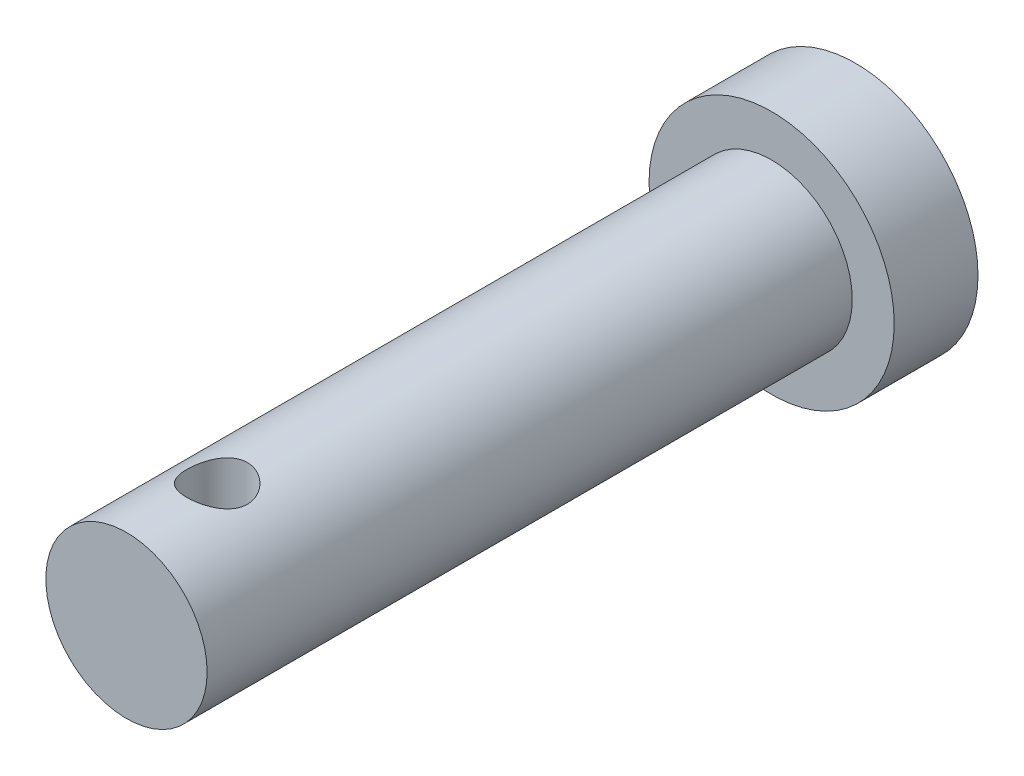
from build123d import *

# Parameters (mm, degrees)
SKETCH1_R               = 4.826
BOSS_EXTRUDE1_DEPTH     = 3.3
SKETCH2_R               = 3.175
BOSS_EXTRUDE2_DEPTH     = 25.4
CUT_EXTRUDE1_DEPTH      = 10
CUT_EXTRUDE1_DEPTH_BACK = 10
SKETCH3_R               = 1.190625


with BuildPart() as part:
    # Sketch1 → Boss-Extrude1 (new body)
    with BuildSketch(Plane.XY):
        Circle(SKETCH1_R)
    extrude(amount=BOSS_EXTRUDE1_DEPTH)

    # Sketch2 → Boss-Extrude2 (add)
    with BuildSketch(Plane.XY.offset(3.3)):
        Circle(SKETCH2_R)
    extrude(amount=BOSS_EXTRUDE2_DEPTH)

    # Sketch3 → Cut-Extrude1 (cut, two sides: drawn at the far end of the back side and taken through both)
    with BuildSketch(Plane(origin=(0, 0, 0), x_dir=(1, 0, 0), z_dir=(0, 1, 0)).offset(-CUT_EXTRUDE1_DEPTH_BACK)):
        with Locations((0, -25.13)):
            Circle(SKETCH3_R)
    extrude(amount=CUT_EXTRUDE1_DEPTH + CUT_EXTRUDE1_DEPTH_BACK, mode=Mode.SUBTRACT)


solid = part.part
